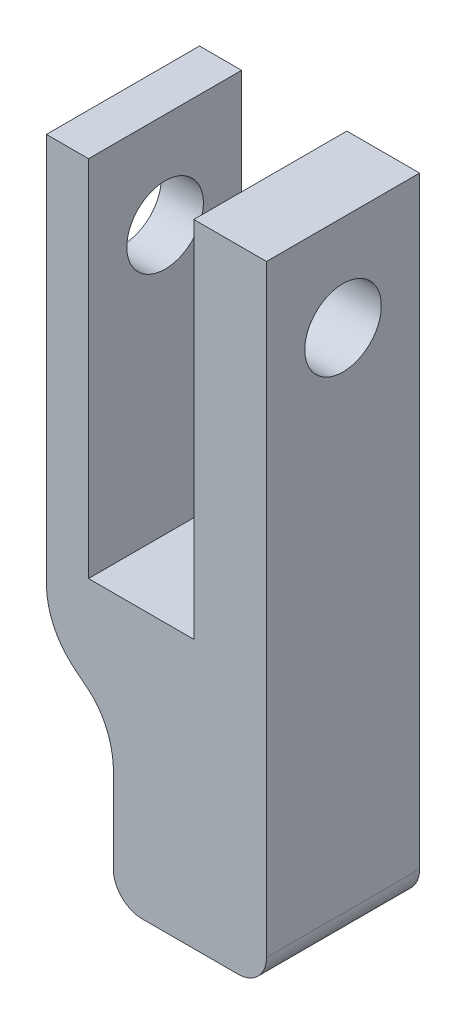
from build123d import *

# Parameters (mm, degrees)
EXTRUDE_1_DEPTH     = 4
SKETCH_2_R          = 1
CUT_EXTRUDE_1_DEPTH = 10
SKETCH_3_R          = 1
CUT_EXTRUDE_2_DEPTH = 5


with BuildPart() as part:
    # 草图1 → 凸台-拉伸1 (new body)
    with BuildSketch(Plane.XY):
        with BuildLine():
            Line((2.873991467, 8.252459404), (2.873991467, -7.497540596))
            add(Edge.make_bspline(
                [(2.873991467, -7.497540596), (2.876380091, -7.703382966), (2.699447856, -8.096674523), (2.307764461, -8.248651724), (2.123991437, -8.247540596)],
                knots=[0, 0, 0, 0, 0.528701234, 1, 1, 1, 1], degree=3))
            Line((2.123991437, -8.247540596), (-0.376008504, -8.247540596))
            add(Edge.make_bspline(
                [(-0.376008504, -8.247540596), (-0.778705468, -8.257378213), (-1.13584565, -7.900237207), (-1.126008504, -7.497540596)],
                knots=[0, 0, 0, 0, 1, 1, 1, 1], degree=3))
            Line((-1.126008504, -7.497540596), (-1.126008504, -5.231853607))
            add(Edge.make_bspline(
                [(-1.126008504, -5.231853607), (-1.13659163, -4.751735199), (-1.378371208, -4.02376985), (-2.103997508, -3.523981437), (-2.680544309, -2.960520138), (-2.876380091, -2.341140701), (-2.876008504, -1.924665096)],
                knots=[0, 0, 0, 0, 0.381620227, 0.529034697, 0.676294459, 1, 1, 1, 1], degree=3))
            Line((-2.876008504, -1.924665096), (-2.876008504, 8.252459404))
            Line((-2.876008504, 8.252459404), (-1.776008599, 8.252459404))
            Line((-1.776008599, 8.252459404), (-1.776008599, -1.247540596))
            Line((-1.776008599, -1.247540596), (0.973991401, -1.247540596))
            Line((0.973991401, -1.247540596), (0.973991401, 8.252459404))
            Line((0.973991401, 8.252459404), (2.873991467, 8.252459404))
        make_face()
    extrude(amount=EXTRUDE_1_DEPTH)

    # 草图2 → 切除-拉伸1 (cut)
    with BuildSketch(Plane.ZY.offset(2.876008504)):
        with Locations((2, 5.752459404)):
            Circle(SKETCH_2_R)
    extrude(amount=-CUT_EXTRUDE_1_DEPTH, mode=Mode.SUBTRACT)

    # 草图3 → 切除-拉伸2 (cut)
    with BuildSketch(Plane.XZ.offset(8.247540596)):
        with Locations(Location((0.873991437, 2, 0), (0, 0, 270))):
            Circle(SKETCH_3_R)
    extrude(amount=-CUT_EXTRUDE_2_DEPTH, mode=Mode.SUBTRACT)


solid = part.part
